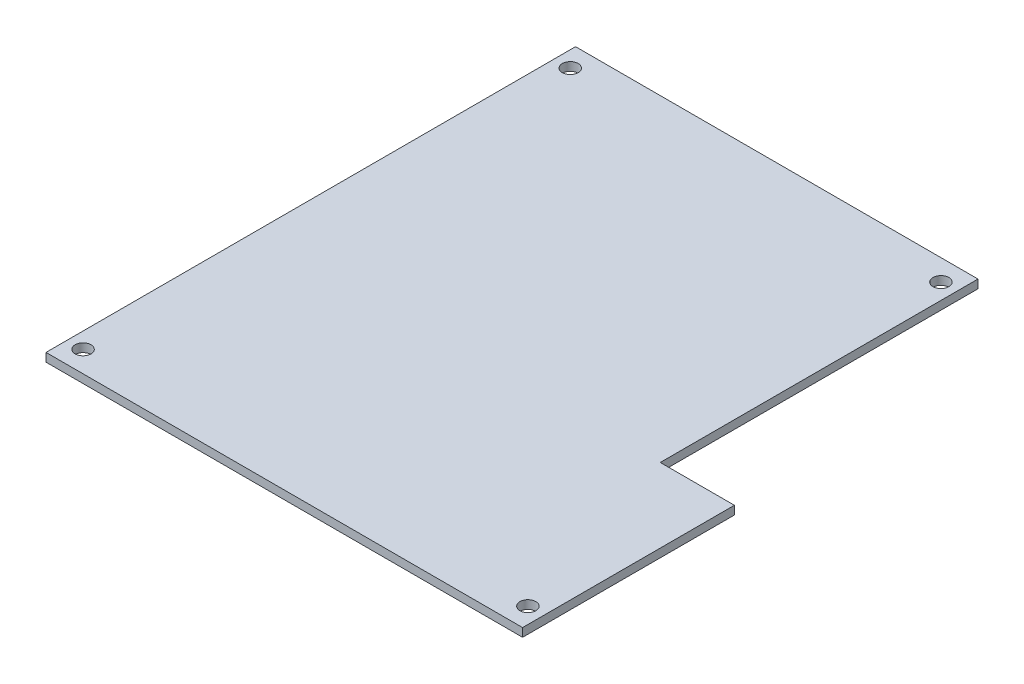
from build123d import *

# Parameters (mm, degrees)
Y_KSEKLIK_EKSTR_ZYON1_DEPTH = 1.6
IZIM2_R                     = 1.5
KES_EKSTR_ZYON1_DEPTH       = 10


with BuildPart() as part:
    # Çizim1 → Yükseklik-Ekstrüzyon1 (new body)
    with BuildSketch(Plane(origin=(0, 0, 0), x_dir=(1, 0, 0), z_dir=(0, 1, 0))):
        Polygon((90, 0), (90, 40), (76, 40), (76, 100), (0, 100), (0, 0), align=None)
    extrude(amount=Y_KSEKLIK_EKSTR_ZYON1_DEPTH)

    # Çizim2 → Kes-Ekstrüzyon1 (cut)
    with BuildSketch(Plane(origin=(0, 1.6, 0), x_dir=(1, 0, 0), z_dir=(0, 1, 0))):
        with Locations(Location((3, 96, 0), (0, 0, 270))):
            Circle(IZIM2_R)
        with Locations(Location((3, 4, 0), (0, 0, 90))):
            Circle(IZIM2_R)
        with Locations(Location((73, 96, 0), (0, 0, 90))):
            Circle(IZIM2_R)
        with Locations(Location((87, 4, 0), (0, 0, 270))):
            Circle(IZIM2_R)
    extrude(amount=-KES_EKSTR_ZYON1_DEPTH, mode=Mode.SUBTRACT)


solid = part.part
